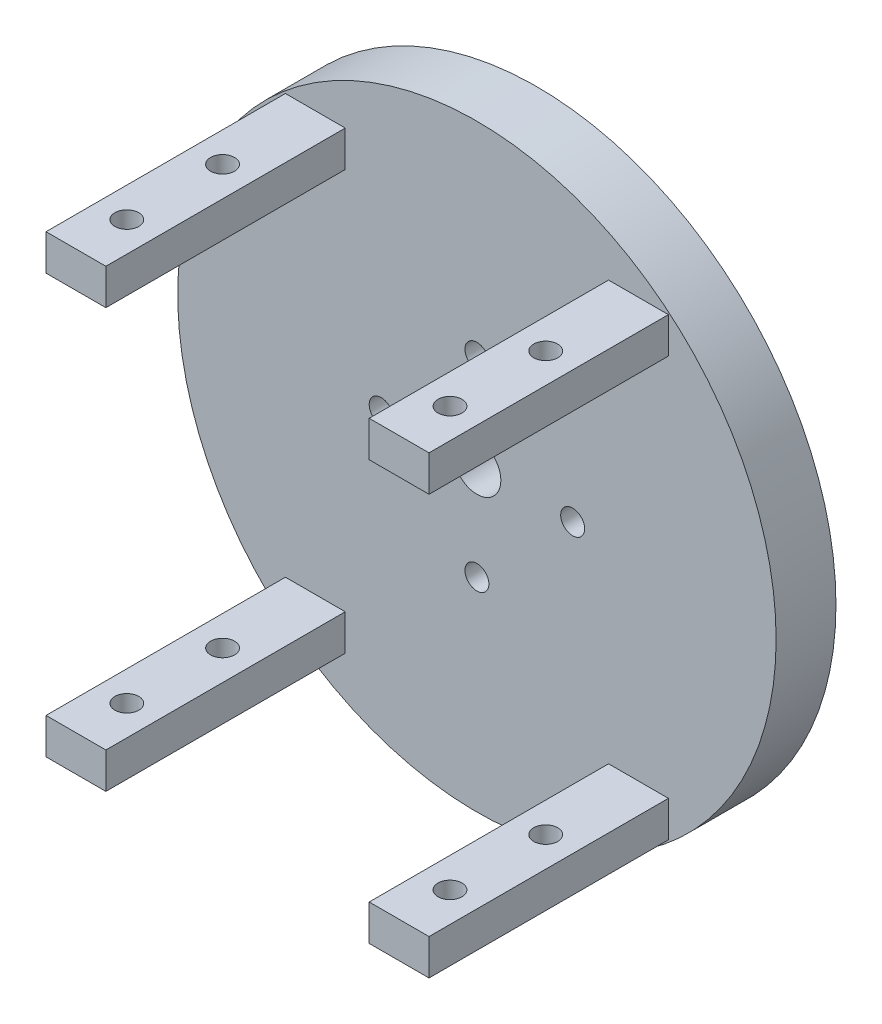
from build123d import *

# Parameters (mm, degrees)
SKETCH1_R           = 25
SKETCH1_R_2         = 1
SKETCH1_R_3         = 2
BOSS_EXTRUDE1_DEPTH = 5
SKETCH2_W           = 5
SKETCH2_H           = 3
BOSS_EXTRUDE2_DEPTH = 20
SKETCH3_R           = 1
CUT_EXTRUDE1_DEPTH  = 57.444663167


with BuildPart() as part:
    # Sketch1 → Boss-Extrude1 (new body)
    with BuildSketch(Plane.XY):
        Circle(SKETCH1_R)
        with Locations((0, 8)):
            Circle(SKETCH1_R_2, mode=Mode.SUBTRACT)
        with Locations((8, 0)):
            Circle(SKETCH1_R_2, mode=Mode.SUBTRACT)
        with Locations((0, -8)):
            Circle(SKETCH1_R_2, mode=Mode.SUBTRACT)
        with Locations((-8, 0)):
            Circle(SKETCH1_R_2, mode=Mode.SUBTRACT)
        Circle(SKETCH1_R_3, mode=Mode.SUBTRACT)
    extrude(amount=BOSS_EXTRUDE1_DEPTH)

    # Sketch2 → Boss-Extrude2 (add)
    with BuildSketch(Plane.XY.offset(5)):
        with Locations((-13.5, 17.5)):
            Rectangle(SKETCH2_W, SKETCH2_H)
        with Locations((13.5, 17.5)):
            Rectangle(SKETCH2_W, SKETCH2_H)
        with Locations((-13.5, -17.5)):
            Rectangle(SKETCH2_W, SKETCH2_H)
        with Locations((13.5, -17.5)):
            Rectangle(SKETCH2_W, SKETCH2_H)
    extrude(amount=BOSS_EXTRUDE2_DEPTH)

    # Sketch3 → Cut-Extrude1 (cut, through all)
    with BuildSketch(Plane.XZ.offset(19)):
        with Locations(Location((-13.5, 20.75, 0), (0, 0, 270))):
            Circle(SKETCH3_R)
        with Locations(Location((-13.5, 12.75, 0), (0, 0, 270))):
            Circle(SKETCH3_R)
        with Locations(Location((13.5, 20.75, 0), (0, 0, 180))):
            Circle(SKETCH3_R)
        with Locations(Location((13.5, 12.75, 0), (0, 0, 180))):
            Circle(SKETCH3_R)
    extrude(amount=-CUT_EXTRUDE1_DEPTH, mode=Mode.SUBTRACT)


solid = part.part
